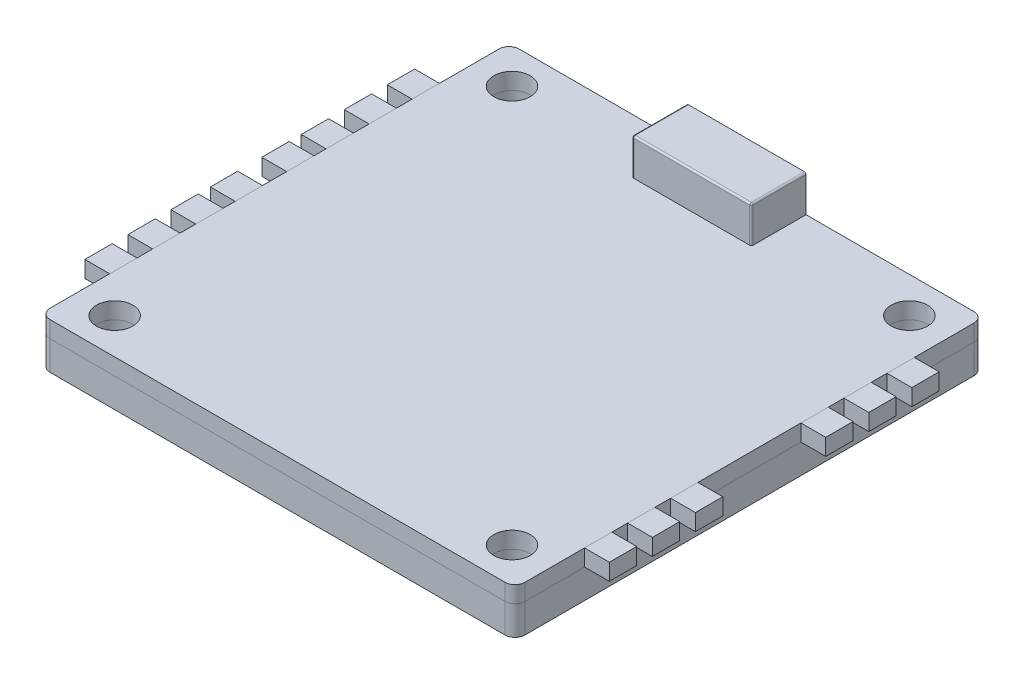
from build123d import *

# Parameters (mm, degrees)
SKETCH1_W                = 36.4236
SKETCH1_H                = 35.9664
SKETCH1_R                = 1.397
BOSS_EXTRUDE1_DEPTH      = 1.27
FILLET1_R                = 0.762
SKETCH6_R                = 1.397
ELECTRONICS_HEIGHT_DEPTH = 2.2352
SKETCH2_W                = 1.905
SKETCH2_H                = 2.096008
ESC_PINS_DEPTH           = 1.27
ESC_PINS_2_DEPTH         = 1.27
ESC_PINS_3_DEPTH         = 1.27
ESC_PINS_4_DEPTH         = 1.27
ESC_PINS_5_DEPTH         = 1.27
ESC_PINS_6_DEPTH         = 1.27
ESC_PINS_7_DEPTH         = 1.27
ESC_PINS_8_DEPTH         = 1.27
ESC_PINS_9_DEPTH         = 1.27
ESC_PINS_10_DEPTH        = 1.27
ESC_PINS_11_DEPTH        = 1.27
ESC_PINS_12_DEPTH        = 1.27
SKETCH5_W                = 1.905
SKETCH5_H                = 2.096008
POWER_PINS_DEPTH         = 1.27
POWER_PINS_2_DEPTH       = 1.27
SKETCH3_W                = 9.144
SKETCH3_H                = 2.794
BOSS_EXTRUDE3_DEPTH      = 4.191
CUT_EXTRUDE1_DEPTH       = 3.429
SKETCH4_R                = 0.1905
BOSS_EXTRUDE4_DEPTH      = 3.048
FILLET2_R                = 0.127


with BuildPart() as part:
    # Sketch1 → Boss-Extrude1 (new body)
    with BuildSketch(Plane(origin=(0, 0, 0), x_dir=(1, 0, 0), z_dir=(0, 1, 0))):
        Rectangle(SKETCH1_W, SKETCH1_H)
        with Locations(Location((-15.24, 15.24, 0), (0, 0, 270))):
            Circle(SKETCH1_R, mode=Mode.SUBTRACT)
        with Locations(Location((15.24, 15.24, 0), (0, 0, 270))):
            Circle(SKETCH1_R, mode=Mode.SUBTRACT)
        with Locations(Location((-15.24, -15.24, 0), (0, 0, 270))):
            Circle(SKETCH1_R, mode=Mode.SUBTRACT)
        with Locations(Location((15.24, -15.24, 0), (0, 0, 270))):
            Circle(SKETCH1_R, mode=Mode.SUBTRACT)
    extrude(amount=BOSS_EXTRUDE1_DEPTH)

    # Fillet1
    fillet1_edges = [part.edges().sort_by_distance(p)[0] for p in [
        (18.2118, 0.635, 17.9832),
        (-18.2118, 0.635, 17.9832),
        (-18.2118, 0.635, -17.9832),
        (18.2118, 0.635, -17.9832),
    ]]
    fillet(fillet1_edges, radius=FILLET1_R)


with BuildPart() as body_2:
    # Sketch6 → Electronics Height (new body)
    with BuildSketch(Plane.XZ):
        with BuildLine():
            Line((-18.2118, 17.2212), (-18.2118, -17.2212))
            ThreePointArc((-18.2118, -17.2212), (-17.988615367, -17.760015367), (-17.4498, -17.9832))
            Line((-17.4498, -17.9832), (17.4498, -17.9832))
            ThreePointArc((17.4498, -17.9832), (17.988615367, -17.760015367), (18.2118, -17.2212))
            Line((18.2118, -17.2212), (18.2118, 17.2212))
            ThreePointArc((18.2118, 17.2212), (17.988615367, 17.760015367), (17.4498, 17.9832))
            Line((17.4498, 17.9832), (-17.4498, 17.9832))
            ThreePointArc((-17.4498, 17.9832), (-17.988615367, 17.760015367), (-18.2118, 17.2212))
        make_face()
        with Locations(Location((-15.24, -15.24, 0), (0, 0, 270))):
            Circle(SKETCH6_R, mode=Mode.SUBTRACT)
        with Locations(Location((15.24, -15.24, 0), (0, 0, 270))):
            Circle(SKETCH6_R, mode=Mode.SUBTRACT)
        with Locations(Location((15.24, 15.24, 0), (0, 0, 270))):
            Circle(SKETCH6_R, mode=Mode.SUBTRACT)
        with Locations(Location((-15.24, 15.24, 0), (0, 0, 270))):
            Circle(SKETCH6_R, mode=Mode.SUBTRACT)
    extrude(amount=ELECTRONICS_HEIGHT_DEPTH)


with BuildPart() as body_3:
    # Sketch2 → ESC Pins (new body)
    with BuildSketch(Plane(origin=(0, 1.27, 0), x_dir=(1, 0, 0), z_dir=(0, 1, 0))):
        with Locations((-19.1643, 11.601196)):
            Rectangle(SKETCH2_W, SKETCH2_H)
    extrude(amount=-ESC_PINS_DEPTH)


with BuildPart() as body_4:
    # Sketch2 → ESC Pins 2 (new body)
    with BuildSketch(Plane(origin=(0, 1.27, 0), x_dir=(1, 0, 0), z_dir=(0, 1, 0))):
        with Locations((-19.1643, 8.299196)):
            Rectangle(SKETCH2_W, SKETCH2_H)
    extrude(amount=-ESC_PINS_2_DEPTH)


with BuildPart() as body_5:
    # Sketch2 → ESC Pins 3 (new body)
    with BuildSketch(Plane(origin=(0, 1.27, 0), x_dir=(1, 0, 0), z_dir=(0, 1, 0))):
        with Locations((-19.1643, 4.997196)):
            Rectangle(SKETCH2_W, SKETCH2_H)
    extrude(amount=-ESC_PINS_3_DEPTH)


with BuildPart() as body_6:
    # Sketch2 → ESC Pins 4 (new body)
    with BuildSketch(Plane(origin=(0, 1.27, 0), x_dir=(1, 0, 0), z_dir=(0, 1, 0))):
        with Locations((19.1643, 4.997196)):
            Rectangle(SKETCH2_W, SKETCH2_H)
    extrude(amount=-ESC_PINS_4_DEPTH)


with BuildPart() as body_7:
    # Sketch2 → ESC Pins 5 (new body)
    with BuildSketch(Plane(origin=(0, 1.27, 0), x_dir=(1, 0, 0), z_dir=(0, 1, 0))):
        with Locations((19.1643, 8.299196)):
            Rectangle(SKETCH2_W, SKETCH2_H)
    extrude(amount=-ESC_PINS_5_DEPTH)


with BuildPart() as body_8:
    # Sketch2 → ESC Pins 6 (new body)
    with BuildSketch(Plane(origin=(0, 1.27, 0), x_dir=(1, 0, 0), z_dir=(0, 1, 0))):
        with Locations((19.1643, 11.601196)):
            Rectangle(SKETCH2_W, SKETCH2_H)
    extrude(amount=-ESC_PINS_6_DEPTH)


with BuildPart() as body_9:
    # Sketch2 → ESC Pins 7 (new body)
    with BuildSketch(Plane(origin=(0, 1.27, 0), x_dir=(1, 0, 0), z_dir=(0, 1, 0))):
        with Locations((19.1643, -11.601196)):
            Rectangle(SKETCH2_W, SKETCH2_H)
    extrude(amount=-ESC_PINS_7_DEPTH)


with BuildPart() as body_10:
    # Sketch2 → ESC Pins 8 (new body)
    with BuildSketch(Plane(origin=(0, 1.27, 0), x_dir=(1, 0, 0), z_dir=(0, 1, 0))):
        with Locations((19.1643, -8.299196)):
            Rectangle(SKETCH2_W, SKETCH2_H)
    extrude(amount=-ESC_PINS_8_DEPTH)


with BuildPart() as body_11:
    # Sketch2 → ESC Pins 9 (new body)
    with BuildSketch(Plane(origin=(0, 1.27, 0), x_dir=(1, 0, 0), z_dir=(0, 1, 0))):
        with Locations((19.1643, -4.997196)):
            Rectangle(SKETCH2_W, SKETCH2_H)
    extrude(amount=-ESC_PINS_9_DEPTH)


with BuildPart() as body_12:
    # Sketch2 → ESC Pins 10 (new body)
    with BuildSketch(Plane(origin=(0, 1.27, 0), x_dir=(1, 0, 0), z_dir=(0, 1, 0))):
        with Locations((-19.1643, -4.997196)):
            Rectangle(SKETCH2_W, SKETCH2_H)
    extrude(amount=-ESC_PINS_10_DEPTH)


with BuildPart() as body_13:
    # Sketch2 → ESC Pins 11 (new body)
    with BuildSketch(Plane(origin=(0, 1.27, 0), x_dir=(1, 0, 0), z_dir=(0, 1, 0))):
        with Locations((-19.1643, -8.299196)):
            Rectangle(SKETCH2_W, SKETCH2_H)
    extrude(amount=-ESC_PINS_11_DEPTH)


with BuildPart() as body_14:
    # Sketch2 → ESC Pins 12 (new body)
    with BuildSketch(Plane(origin=(0, 1.27, 0), x_dir=(1, 0, 0), z_dir=(0, 1, 0))):
        with Locations((-19.1643, -11.601196)):
            Rectangle(SKETCH2_W, SKETCH2_H)
    extrude(amount=-ESC_PINS_12_DEPTH)


with BuildPart() as body_15:
    # Sketch5 → Power Pins (new body)
    with BuildSketch(Plane(origin=(0, 1.27, 0), x_dir=(1, 0, 0), z_dir=(0, 1, 0))):
        with Locations((-19.1643, 1.975104)):
            Rectangle(SKETCH5_W, SKETCH5_H)
    extrude(amount=-POWER_PINS_DEPTH)


with BuildPart() as body_16:
    # Sketch5 → Power Pins 2 (new body)
    with BuildSketch(Plane(origin=(0, 1.27, 0), x_dir=(1, 0, 0), z_dir=(0, 1, 0))):
        with Locations((-19.1643, -1.975104)):
            Rectangle(SKETCH5_W, SKETCH5_H)
    extrude(amount=-POWER_PINS_2_DEPTH)


with BuildPart() as body_17:
    # Sketch3 → Boss-Extrude3 (new body)
    # profile 1 of 3: a face of its own
    with BuildSketch(Plane(origin=(0, 0, -17.9832), x_dir=(-1, 0, 0), z_dir=(0, 0, -1))):
        with Locations((0, 2.667)):
            Rectangle(SKETCH3_W, SKETCH3_H)
        Polygon((-3.81, 3.556), (0, 3.556), (3.81, 3.556), (3.81, 3.175), (4.064, 3.175), (4.064, 2.667), (3.81, 2.667), (3.81, 1.524), (0, 1.524), (-3.81, 1.524), (-3.81, 2.667), (-4.064, 2.667), (-4.064, 3.175), (-3.81, 3.175), align=None, mode=Mode.SUBTRACT)
    # profile 2 of 3: a face of its own
    with BuildSketch(Plane(origin=(0, 0, -17.9832), x_dir=(-1, 0, 0), z_dir=(0, 0, -1))):
        Polygon((3.81, 3.556), (0, 3.556), (0, 1.524), (3.81, 1.524), (3.81, 2.667), (4.064, 2.667), (4.064, 3.175), (3.81, 3.175), align=None)
    # profile 3 of 3: a face of its own
    with BuildSketch(Plane(origin=(0, 0, -17.9832), x_dir=(-1, 0, 0), z_dir=(0, 0, -1))):
        Polygon((0, 1.524), (0, 3.556), (-3.81, 3.556), (-3.81, 3.175), (-4.064, 3.175), (-4.064, 2.667), (-3.81, 2.667), (-3.81, 1.524), align=None)
    extrude(amount=-BOSS_EXTRUDE3_DEPTH)

    # Sketch3<3> → Cut-Extrude1 (cut)
    with BuildSketch(Plane(origin=(0, 0, -17.9832), x_dir=(-1, 0, 0), z_dir=(0, 0, -1))):
        Polygon((0, 1.524), (0, 3.556), (-3.81, 3.556), (-3.81, 3.175), (-4.064, 3.175), (-4.064, 2.667), (-3.81, 2.667), (-3.81, 1.524), align=None)
        Polygon((3.81, 3.556), (0, 3.556), (0, 1.524), (3.81, 1.524), (3.81, 2.667), (4.064, 2.667), (4.064, 3.175), (3.81, 3.175), align=None)
    extrude(amount=-CUT_EXTRUDE1_DEPTH, mode=Mode.SUBTRACT)

    # Sketch4 → Boss-Extrude4 (add)
    with BuildSketch(Plane(origin=(0, 0, -14.5542), x_dir=(-1, 0, 0), z_dir=(0, 0, -1))):
        with Locations((-3.189857121, 2.921)):
            Circle(SKETCH4_R)
        with Locations((-1.919857121, 2.921)):
            Circle(SKETCH4_R)
        with Locations((-0.649857121, 2.921)):
            Circle(SKETCH4_R)
        with Locations((0.620142879, 2.921)):
            Circle(SKETCH4_R)
        with Locations((1.890142879, 2.921)):
            Circle(SKETCH4_R)
        with Locations((3.160142879, 2.921)):
            Circle(SKETCH4_R)
    extrude(amount=BOSS_EXTRUDE4_DEPTH)

    # Fillet2
    fillet2_edges = [body_17.edges().sort_by_distance(p)[0] for p in [
        (0, 4.064, -13.7922),
        (4.572, 2.667, -13.7922),
        (4.572, 4.064, -15.8877),
        (-4.572, 4.064, -15.8877),
        (-4.572, 2.667, -13.7922),
    ]]
    fillet(fillet2_edges, radius=FILLET2_R)


solid = Compound([part.part, body_2.part, body_3.part, body_4.part, body_5.part, body_6.part, body_7.part, body_8.part, body_9.part, body_10.part, body_11.part, body_12.part, body_13.part, body_14.part, body_15.part, body_16.part, body_17.part])
